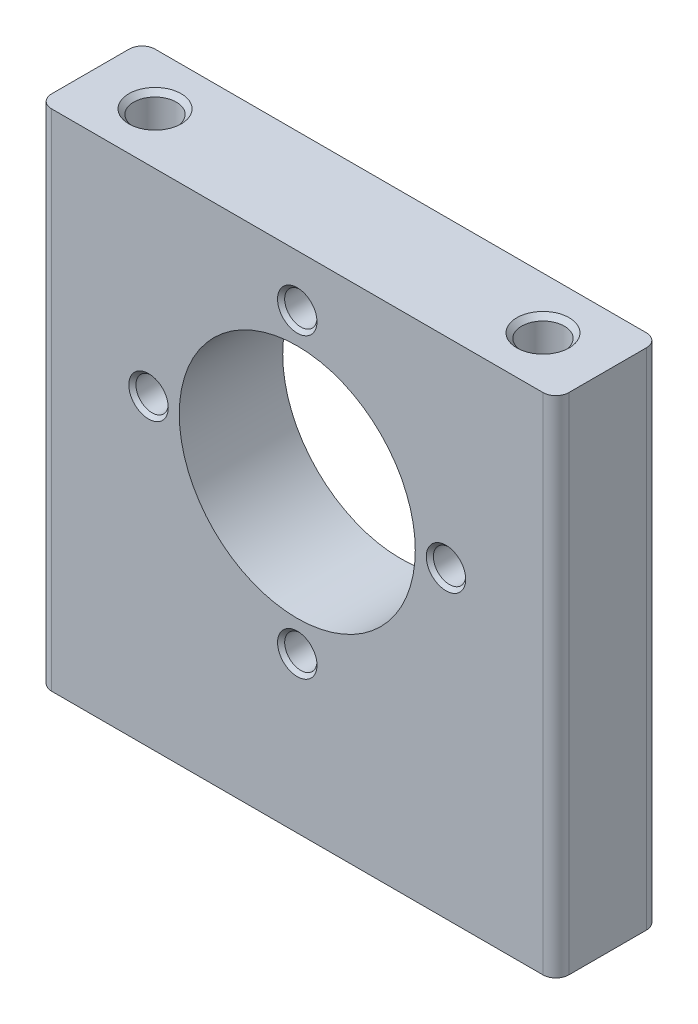
from build123d import *

# Parameters (mm, degrees)
SKETCH_1_W                   = 40
SKETCH_1_H                   = 8
EXTRUDE_1_DEPTH              = 39
HOLE_WIZARD_M4_1_D           = 3.3
HOLE_WIZARD_M4_1_DEPTH       = 9.108579979
HOLE_WIZARD_M4_1_CSINK_D     = 4.05
HOLE_WIZARD_M4_1_CSINK_ANGLE = 90
HOLE_WIZARD_M4_1_TIP         = 0.991420021
SKETCH_5_R                   = 9.125
CUT_EXTRUDE_1_DEPTH          = 39
HOLE_WIZARD_M4_2_D           = 3.3
HOLE_WIZARD_M4_2_DEPTH       = 9.108579979
HOLE_WIZARD_M4_2_CSINK_D     = 4.05
HOLE_WIZARD_M4_2_CSINK_ANGLE = 90
HOLE_WIZARD_M4_2_TIP         = 0.991420021
HOLE_WIZARD_M3_1_D           = 2.5
HOLE_WIZARD_M3_1_CSINK_D     = 3.05
HOLE_WIZARD_M3_1_CSINK_ANGLE = 90
FILLET_1_R                   = 1


with BuildPart() as part:
    # 草图1 → 凸台-拉伸1 (new body)
    with BuildSketch(Plane(origin=(0, 0, 0), x_dir=(1, 0, 0), z_dir=(0, 1, 0))):
        Rectangle(SKETCH_1_W, SKETCH_1_H)
    extrude(amount=EXTRUDE_1_DEPTH)

    # M4 螺纹孔1
    with Locations(Plane(origin=(0, 39, 0), x_dir=(1, 0, 0), z_dir=(0, 1, 0))):
        with Locations((-15, 0), (15, 0)):
            CounterSinkHole(HOLE_WIZARD_M4_1_D / 2, HOLE_WIZARD_M4_1_CSINK_D / 2, depth=HOLE_WIZARD_M4_1_DEPTH, counter_sink_angle=HOLE_WIZARD_M4_1_CSINK_ANGLE)
            with Locations((0, 0, -(HOLE_WIZARD_M4_1_DEPTH + HOLE_WIZARD_M4_1_TIP / 2))):  # 118° drill point
                Cone(0, HOLE_WIZARD_M4_1_D / 2, HOLE_WIZARD_M4_1_TIP, mode=Mode.SUBTRACT)

    # 草图5 → 切除-拉伸1 (cut)
    with BuildSketch(Plane.XY.offset(4)):
        with Locations((0, 23.5)):
            Circle(SKETCH_5_R)
    extrude(amount=-CUT_EXTRUDE_1_DEPTH, mode=Mode.SUBTRACT)

    # M4 螺纹孔2
    with Locations(Plane(origin=(0, 0, 0), x_dir=(-1, 0, 0), z_dir=(0, -1, 0))):
        with Locations((15, 0), (-15, 0)):
            CounterSinkHole(HOLE_WIZARD_M4_2_D / 2, HOLE_WIZARD_M4_2_CSINK_D / 2, depth=HOLE_WIZARD_M4_2_DEPTH, counter_sink_angle=HOLE_WIZARD_M4_2_CSINK_ANGLE)
            with Locations((0, 0, -(HOLE_WIZARD_M4_2_DEPTH + HOLE_WIZARD_M4_2_TIP / 2))):  # 118° drill point
                Cone(0, HOLE_WIZARD_M4_2_D / 2, HOLE_WIZARD_M4_2_TIP, mode=Mode.SUBTRACT)

    # M3 螺纹孔1 (through all)
    with Locations(Plane.XY.offset(4)):
        with Locations((0, 35), (-11.5, 23.5), (11.5, 23.5), (0, 12)):
            CounterSinkHole(HOLE_WIZARD_M3_1_D / 2, HOLE_WIZARD_M3_1_CSINK_D / 2, counter_sink_angle=HOLE_WIZARD_M3_1_CSINK_ANGLE)

    # 圆角1
    fillet_1_edges = [part.edges().sort_by_distance(p)[0] for p in [
        (20, 19.5, 4),
        (-20, 19.5, 4),
        (-20, 19.5, -4),
        (20, 19.5, -4),
    ]]
    fillet(fillet_1_edges, radius=FILLET_1_R)


solid = part.part
